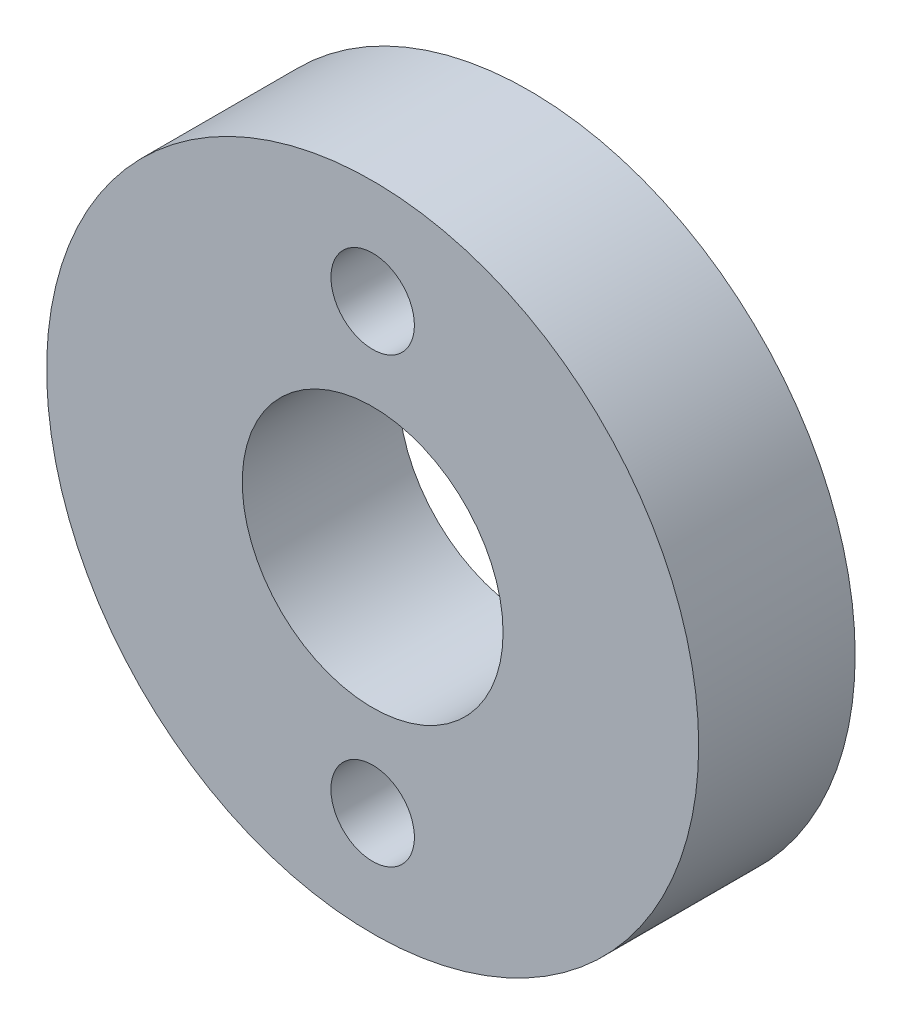
from build123d import *

# Parameters (mm, degrees)
SKETCH_1_R               = 12.5
EXTRUDE_1_DEPTH          = 3
CUT_EXTRUDE_1_DEPTH      = 18.930421077
CUT_EXTRUDE_1_DEPTH_BACK = 18.930421077
SKETCH_2_R               = 5
SKETCH_3_R               = 1.6
CUT_EXTRUDE_2_DEPTH      = 19.668154703
PATTERN_CIRCULAR_1_COUNT = 2


with BuildPart() as part:
    # ｽｹｯﾁ1 → ﾎﾞｽ - 押し出し1 (new, symmetric)
    with BuildSketch(Plane.XY):
        Circle(SKETCH_1_R)
    extrude(amount=EXTRUDE_1_DEPTH, both=True)

    # ｽｹｯﾁ2 → ｶｯﾄ - 押し出し1 (cut, two sides: drawn at the far end of the back side and taken through both)
    with BuildSketch(Plane.XY.offset(-CUT_EXTRUDE_1_DEPTH_BACK)):
        Circle(SKETCH_2_R)
    extrude(amount=CUT_EXTRUDE_1_DEPTH + CUT_EXTRUDE_1_DEPTH_BACK, mode=Mode.SUBTRACT)

    # ｽｹｯﾁ3 → ｶｯﾄ - 押し出し2 (cut, symmetric)
    with BuildSketch(Plane.XY.offset(3)):
        with Locations((0, 8.5)):
            Circle(SKETCH_3_R)
    cut_extrude_2 = extrude(amount=CUT_EXTRUDE_2_DEPTH, both=True, mode=Mode.SUBTRACT)

    # 円形ﾊﾟﾀｰﾝ1: ｶｯﾄ - 押し出し2 ×2 about axis
    pattern_circular_1_axis = Axis((0, 0, 0), (0, 0, 1))
    for i in range(1, PATTERN_CIRCULAR_1_COUNT):
        add(cut_extrude_2.rotate(pattern_circular_1_axis, i * 360 / PATTERN_CIRCULAR_1_COUNT), mode=Mode.SUBTRACT)


solid = part.part
